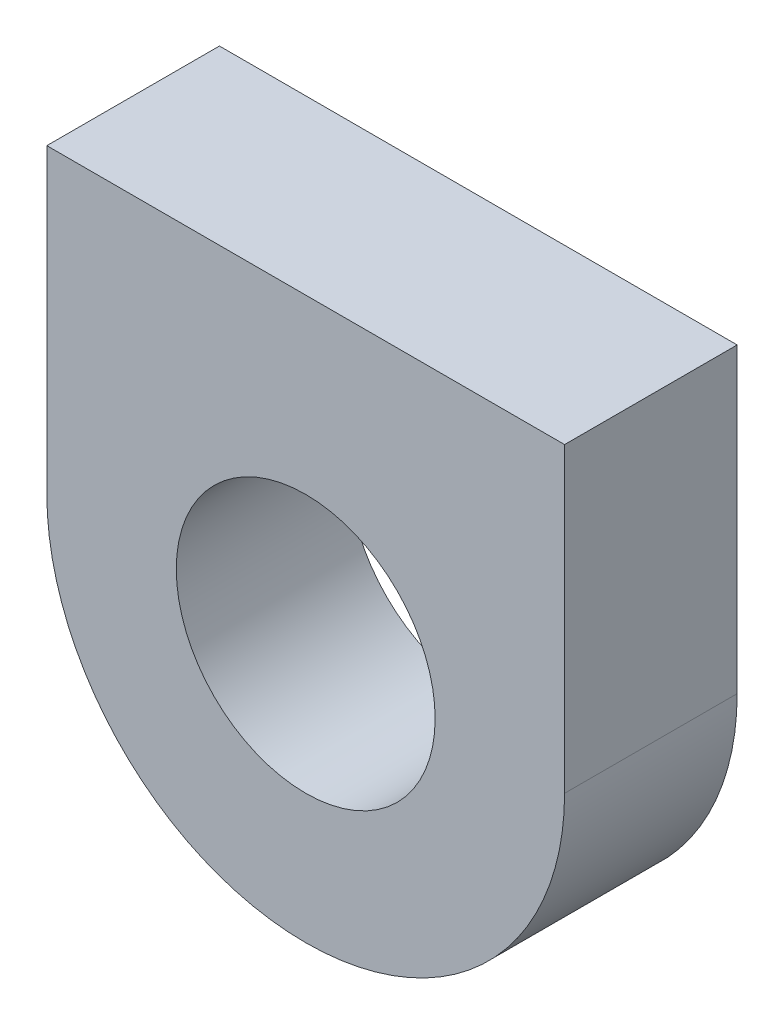
from build123d import *

# Parameters (mm, degrees)
SKETCH1_R           = 15
BOSS_EXTRUDE1_DEPTH = 10


with BuildPart() as part:
    # Sketch1 → Boss-Extrude1 (new, symmetric)
    with BuildSketch(Plane.XY):
        with BuildLine():
            Line((-30, 0), (-30, 35))
            Line((-30, 35), (30, 35))
            Line((30, 35), (30, 0))
            ThreePointArc((30, 0), (0, -30), (-30, 0))
        make_face()
        Circle(SKETCH1_R, mode=Mode.SUBTRACT)
    extrude(amount=BOSS_EXTRUDE1_DEPTH, both=True)


solid = part.part
